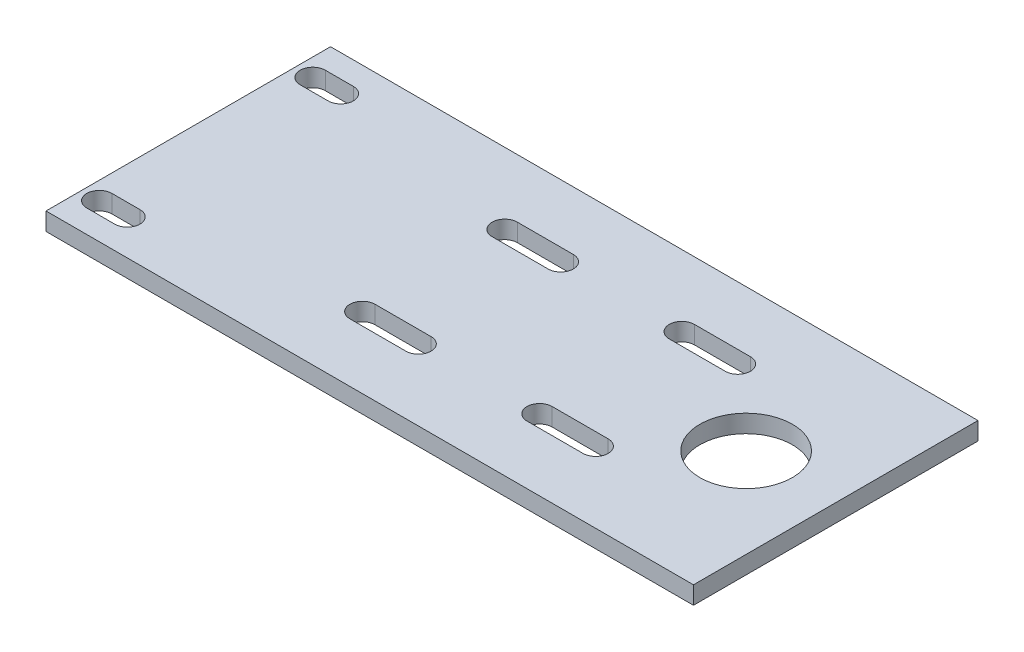
from build123d import *

# Parameters (mm, degrees)
SKETCH1_W           = 125
SKETCH1_H           = 50.8
BOSS_EXTRUDE1_DEPTH = 3.175
SKETCH2_R           = 8.255
CUT_EXTRUDE1_DEPTH  = 135.965627569
SKETCH3_W           = 9.4
SKETCH3_H           = 50.8
CUT_EXTRUDE2_DEPTH  = 10


with BuildPart() as part:
    # Sketch1 → Boss-Extrude1 (new body)
    with BuildSketch(Plane(origin=(0, 0, 0), x_dir=(1, 0, 0), z_dir=(0, 1, 0))):
        with Locations((62.5, 25.4)):
            Rectangle(SKETCH1_W, SKETCH1_H)
    extrude(amount=BOSS_EXTRUDE1_DEPTH)

    # Sketch2 → Cut-Extrude1 (cut, through all)
    with BuildSketch(Plane(origin=(0, 3.175, 0), x_dir=(1, 0, 0), z_dir=(0, 1, 0))):
        with Locations(Location((99.6, 25.4, 0), (0, 0, 270))):
            Circle(SKETCH2_R)
        with BuildLine():
            Line((3.175, 42.2), (8.175, 42.2))
            ThreePointArc((8.175, 42.2), (10.425, 44.45), (8.175, 46.7))
            Line((8.175, 46.7), (3.175, 46.7))
            ThreePointArc((3.175, 46.7), (0.925, 44.45), (3.175, 42.2))
        make_face()
        with BuildLine():
            Line((3.175, 4.1), (8.175, 4.1))
            ThreePointArc((8.175, 4.1), (10.425, 6.35), (8.175, 8.6))
            Line((8.175, 8.6), (3.175, 8.6))
            ThreePointArc((3.175, 8.6), (0.925, 6.35), (3.175, 4.1))
        make_face()
        with BuildLine():
            Line((80.425, 40.35), (85.425, 40.35))
            ThreePointArc((85.425, 40.35), (87.675, 38.1), (85.425, 35.85))
            Line((85.425, 35.85), (80.425, 35.85))
            Line((80.425, 35.85), (75.425, 35.85))
            ThreePointArc((75.425, 35.85), (73.175, 38.1), (75.425, 40.35))
            Line((75.425, 40.35), (80.425, 40.35))
        make_face()
        with BuildLine():
            Line((48.8, 35.85), (43.8, 35.85))
            ThreePointArc((43.8, 35.85), (41.55, 38.1), (43.8, 40.35))
            Line((43.8, 40.35), (48.8, 40.35))
            Line((48.8, 40.35), (53.8, 40.35))
            ThreePointArc((53.8, 40.35), (56.05, 38.1), (53.8, 35.85))
            Line((53.8, 35.85), (48.8, 35.85))
        make_face()
        with BuildLine():
            Line((48.8, 10.45), (43.8, 10.45))
            ThreePointArc((43.8, 10.45), (41.55, 12.7), (43.8, 14.95))
            Line((43.8, 14.95), (48.8, 14.95))
            Line((48.8, 14.95), (53.8, 14.95))
            ThreePointArc((53.8, 14.95), (56.05, 12.7), (53.8, 10.45))
            Line((53.8, 10.45), (48.8, 10.45))
        make_face()
        with BuildLine():
            Line((80.425, 10.45), (75.425, 10.45))
            ThreePointArc((75.425, 10.45), (73.175, 12.7), (75.425, 14.95))
            Line((75.425, 14.95), (80.425, 14.95))
            Line((80.425, 14.95), (85.425, 14.95))
            ThreePointArc((85.425, 14.95), (87.675, 12.7), (85.425, 10.45))
            Line((85.425, 10.45), (80.425, 10.45))
        make_face()
    extrude(amount=-CUT_EXTRUDE1_DEPTH, mode=Mode.SUBTRACT)

    # Sketch3 → Cut-Extrude2 (cut)
    with BuildSketch(Plane(origin=(0, 3.175, 0), x_dir=(1, 0, 0), z_dir=(0, 1, 0))):
        with Locations((120.3, 25.4)):
            Rectangle(SKETCH3_W, SKETCH3_H)
    extrude(amount=-CUT_EXTRUDE2_DEPTH, mode=Mode.SUBTRACT)


solid = part.part
